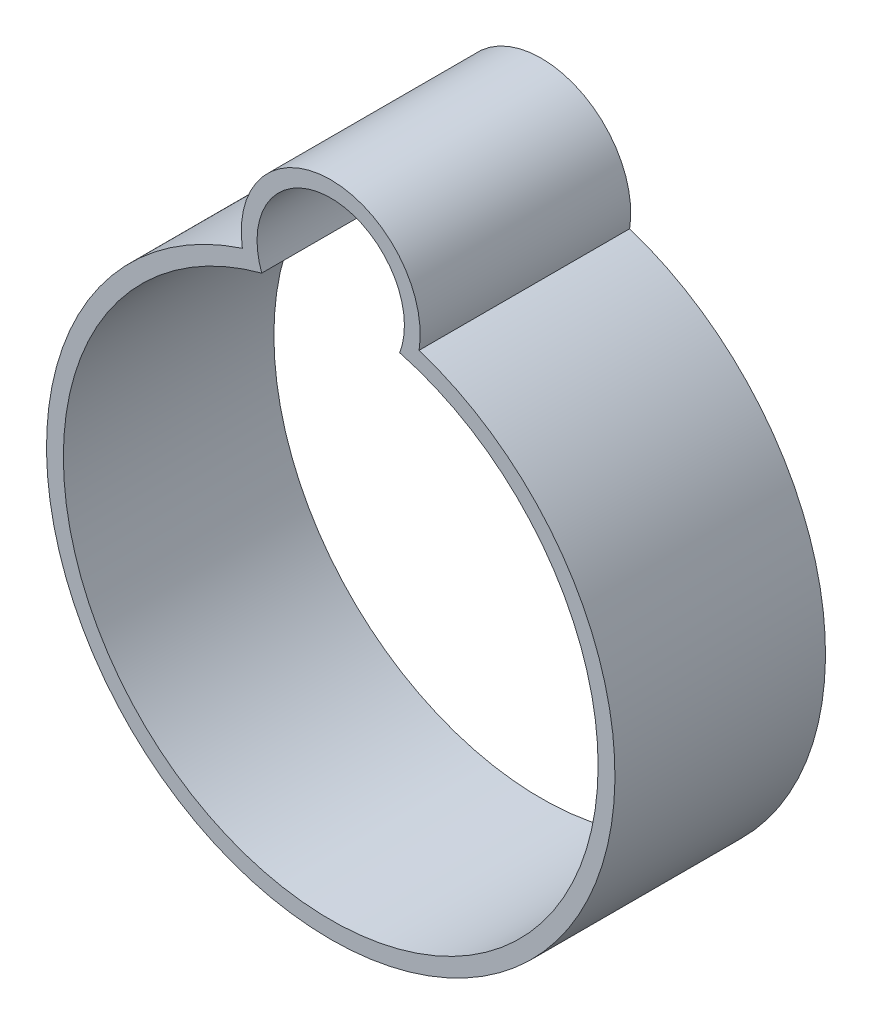
from build123d import *

# Parameters (mm, degrees)
EXTRUDE_1_DEPTH = 10


with BuildPart() as part:
    # ｽｹｯﾁ1 → ﾎﾞｽ - 押し出し1 (new body)
    with BuildSketch(Plane.XY):
        with BuildLine():
            ThreePointArc((-4.197018439, 12.831018519), (0, -13.5), (4.197018439, 12.831018519))
            ThreePointArc((4.197018439, 12.831018519), (0, 17.75), (-4.197018439, 12.831018519))
        make_face()
        with BuildLine():
            ThreePointArc((3.27675144, 12.27), (0, 17), (-3.27675144, 12.27))
            ThreePointArc((-3.27675144, 12.27), (0, -12.7), (3.27675144, 12.27))
        make_face(mode=Mode.SUBTRACT)
    extrude(amount=EXTRUDE_1_DEPTH)


solid = part.part
